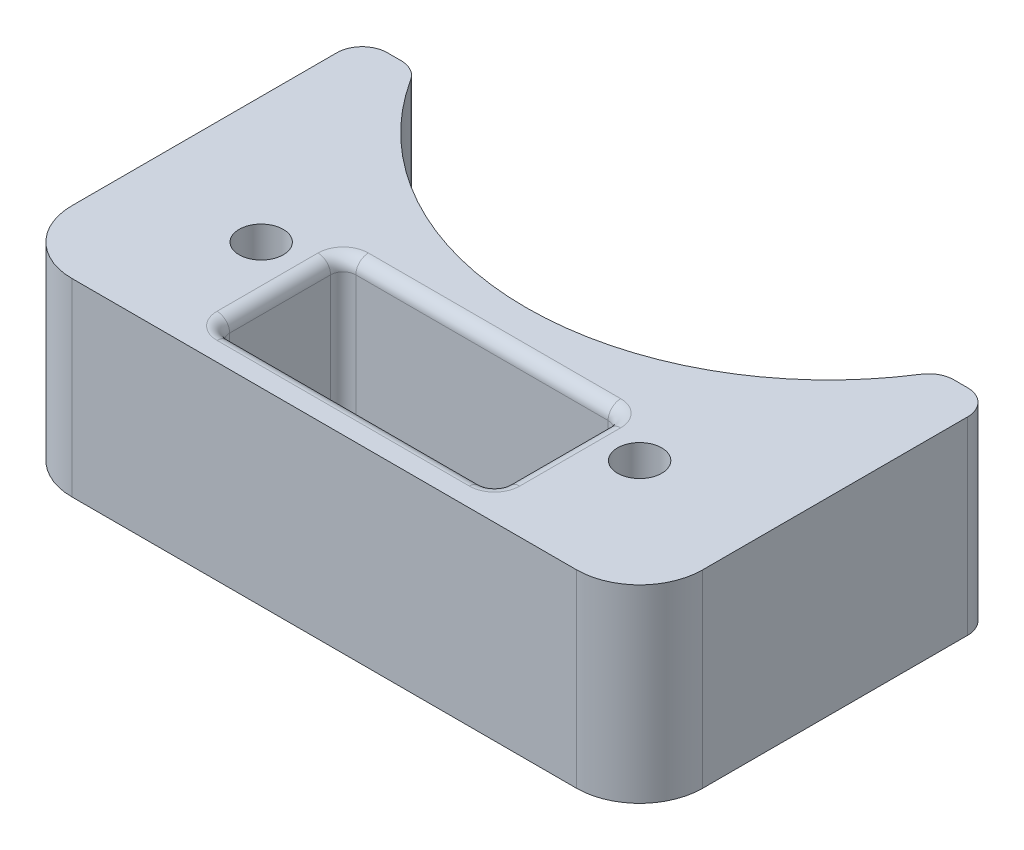
from build123d import *

# Parameters (mm, degrees)
SKETCH_1_W          = 50
SKETCH_1_H          = 50
SKETCH_1_R          = 21.05
EXTRUDE_1_DEPTH     = 15
SKETCH_2_W          = 50
SKETCH_2_H          = 30
SKETCH_2_R          = 1.6
EXTRUDE_2_DEPTH     = 15
FILLET_1_R          = 3
SKETCH_3_R          = 1.75
CUT_EXTRUDE_1_DEPTH = 63.24949799
SKETCH_4_R          = 1.6
CUT_EXTRUDE_2_DEPTH = 63.24949799
FILLET_2_R          = 2
FILLET_3_R          = 5
SKETCH_5_W          = 22
SKETCH_5_H          = 10
CUT_EXTRUDE_3_DEPTH = 50.497474683
FILLET_4_R          = 1


with BuildPart() as part:
    # 草图1 → 凸台-拉伸1 (new body)
    with BuildSketch(Plane(origin=(0, 0, 0), x_dir=(1, 0, 0), z_dir=(0, 1, 0))):
        Rectangle(SKETCH_1_W, SKETCH_1_H)
        with Locations(Location((0, 0, 0), (0, 0, 270))):
            Circle(SKETCH_1_R, mode=Mode.SUBTRACT)
    extrude(amount=EXTRUDE_1_DEPTH)

    # 草图2 → 凸台-拉伸2 (add)
    with BuildSketch(Plane(origin=(0, 15, 0), x_dir=(1, 0, 0), z_dir=(0, 1, 0))):
        with Locations((0, -40)):
            Rectangle(SKETCH_2_W, SKETCH_2_H)
        with Locations(Location((-15, -47.5, 0), (0, 0, 270))):
            Circle(SKETCH_2_R, mode=Mode.SUBTRACT)
        with Locations(Location((15, -47.5, 0), (0, 0, 270))):
            Circle(SKETCH_2_R, mode=Mode.SUBTRACT)
    extrude(amount=-EXTRUDE_2_DEPTH)

    # 圆角1
    fillet_1_edges = [part.edges().sort_by_distance(p)[0] for p in [
        (25, 7.5, 55),
        (-25, 7.5, 55),
        (-25, 7.5, -25),
        (25, 7.5, -25),
    ]]
    fillet(fillet_1_edges, radius=FILLET_1_R)

    # 草图3 → 切除-拉伸1 (cut, through all)
    with BuildSketch(Plane(origin=(0, 15, 0), x_dir=(1, 0, 0), z_dir=(0, 1, 0))):
        with Locations(Location((-15, -30, 0), (0, 0, 270))):
            Circle(SKETCH_3_R)
        with Locations(Location((15, -30, 0), (0, 0, 270))):
            Circle(SKETCH_3_R)
    extrude(amount=-CUT_EXTRUDE_1_DEPTH, mode=Mode.SUBTRACT)

    # 草图4 → 切除-拉伸2 (cut, through all)
    # profile 1 of 6: a face of its own
    with BuildSketch(Plane(origin=(0, 15, 0), x_dir=(1, 0, 0), z_dir=(0, 1, 0))):
        with BuildLine():
            Line((25, -40), (-25, -40))
            Line((-25, -40), (-25, -52))
            ThreePointArc((-25, -52), (-24.121320344, -54.121320344), (-22, -55))
            Line((-22, -55), (22, -55))
            ThreePointArc((22, -55), (24.121320344, -54.121320344), (25, -52))
            Line((25, -52), (25, -40))
        make_face()
        with Locations((-15, -47.5)):
            Circle(SKETCH_4_R, mode=Mode.SUBTRACT)
        with Locations((15, -47.5)):
            Circle(SKETCH_4_R, mode=Mode.SUBTRACT)
    # profile 2 of 6: a face of its own
    with BuildSketch(Plane(origin=(0, 15, 0), x_dir=(1, 0, 0), z_dir=(0, 1, 0))):
        with BuildLine():
            Line((-25, 22), (-25, -12))
            Line((-25, -12), (-20.784609691, -12))
            ThreePointArc((-20.784609691, -12), (-6.211657082, 23.182219831), (24, 0))
            ThreePointArc((24, 0), (23.182219831, -6.211657082), (20.784609691, -12))
            Line((20.784609691, -12), (25, -12))
            Line((25, -12), (25, 22))
            ThreePointArc((25, 22), (24.121320344, 24.121320344), (22, 25))
            Line((22, 25), (-22, 25))
            ThreePointArc((-22, 25), (-24.121320344, 24.121320344), (-25, 22))
        make_face()
    # profile 3 of 6: a face of its own
    with BuildSketch(Plane(origin=(0, 15, 0), x_dir=(1, 0, 0), z_dir=(0, 1, 0))):
        with BuildLine():
            ThreePointArc((24, 0), (-6.211657082, 23.182219831), (-20.784609691, -12))
            Line((-20.784609691, -12), (-17.294580076, -12))
            ThreePointArc((-17.294580076, -12), (-6.286954326, 20.089218633), (21.05, 0))
            ThreePointArc((21.05, 0), (20.089218633, -6.286954326), (17.294580076, -12))
            Line((17.294580076, -12), (20.784609691, -12))
            ThreePointArc((20.784609691, -12), (23.182219831, -6.211657082), (24, 0))
        make_face()
    # profile 4 of 6: a face of its own
    with BuildSketch(Plane(origin=(0, 15, 0), x_dir=(1, 0, 0), z_dir=(0, 1, 0))):
        with BuildLine():
            Line((-17.294580076, -12), (-20.784609691, -12))
            ThreePointArc((-20.784609691, -12), (0, -24), (20.784609691, -12))
            Line((20.784609691, -12), (17.294580076, -12))
            ThreePointArc((17.294580076, -12), (0, -21.05), (-17.294580076, -12))
        make_face()
    # profile 5 of 6: a face of its own
    with BuildSketch(Plane(origin=(0, 15, 0), x_dir=(1, 0, 0), z_dir=(0, 1, 0))):
        with BuildLine():
            ThreePointArc((24, 0), (-6.211657082, 23.182219831), (-20.784609691, -12))
            Line((-20.784609691, -12), (-17.294580076, -12))
            ThreePointArc((-17.294580076, -12), (-6.286954326, 20.089218633), (21.05, 0))
            ThreePointArc((21.05, 0), (20.089218633, -6.286954326), (17.294580076, -12))
            Line((17.294580076, -12), (20.784609691, -12))
            ThreePointArc((20.784609691, -12), (23.182219831, -6.211657082), (24, 0))
        make_face()
    # profile 6 of 6: a face of its own
    with BuildSketch(Plane(origin=(0, 15, 0), x_dir=(1, 0, 0), z_dir=(0, 1, 0))):
        with BuildLine():
            Line((-17.294580076, -12), (-20.784609691, -12))
            ThreePointArc((-20.784609691, -12), (0, -24), (20.784609691, -12))
            Line((20.784609691, -12), (17.294580076, -12))
            ThreePointArc((17.294580076, -12), (0, -21.05), (-17.294580076, -12))
        make_face()
    extrude(amount=-CUT_EXTRUDE_2_DEPTH, mode=Mode.SUBTRACT)

    # 圆角2
    fillet_2_edges = [part.edges().sort_by_distance(p)[0] for p in [
        (20.784609691, 7.5, 12),
        (-20.784609691, 7.5, 12),
        (-25, 7.5, 12),
        (25, 7.5, 12),
    ]]
    fillet(fillet_2_edges, radius=FILLET_2_R)

    # 圆角3
    fillet_3_edges = [part.edges().sort_by_distance(p)[0] for p in [
        (-25, 7.5, 40),
        (25, 7.5, 40),
    ]]
    fillet(fillet_3_edges, radius=FILLET_3_R)

    # 草图5 → 切除-拉伸3 (cut, through all)
    with BuildSketch(Plane(origin=(0, 15, 0), x_dir=(1, 0, 0), z_dir=(0, 1, 0))):
        with Locations((0, -32.5)):
            Rectangle(SKETCH_5_W, SKETCH_5_H)
    extrude(amount=-CUT_EXTRUDE_3_DEPTH, mode=Mode.SUBTRACT)

    # 圆角4
    fillet_4_edges = [part.edges().sort_by_distance(p)[0] for p in [
        (11, 0, 32.5),
        (11, 7.5, 27.5),
        (0, 0, 37.5),
        (11, 7.5, 37.5),
        (-11, 0, 32.5),
        (-11, 7.5, 37.5),
        (0, 0, 27.5),
        (-11, 7.5, 27.5),
        (11, 15, 32.5),
        (0, 15, 27.5),
        (-11, 15, 32.5),
        (0, 15, 37.5),
    ]]
    fillet(fillet_4_edges, radius=FILLET_4_R)


solid = part.part
